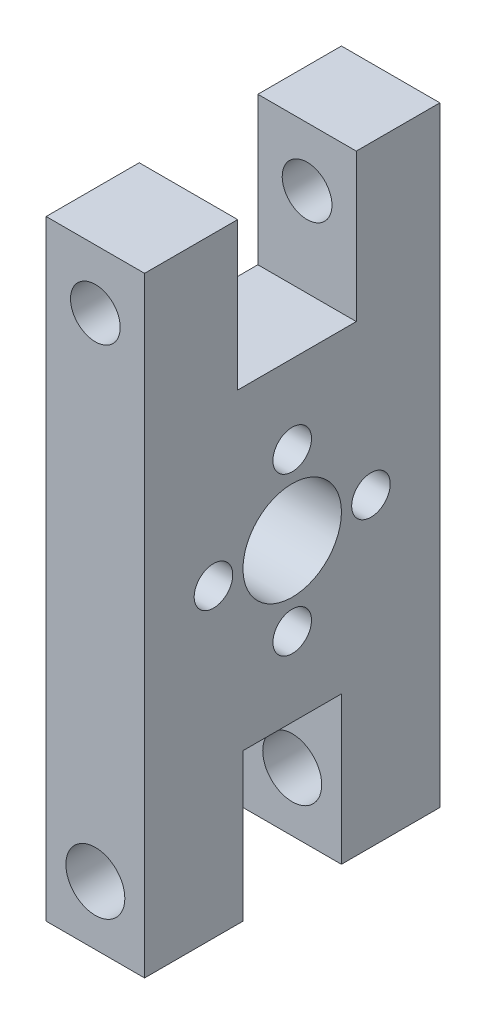
from build123d import *

# Parameters (mm, degrees)
CROQUIS1_R              = 5
CROQUIS1_R_2            = 1.95828143
SALIENTE_EXTRUIR1_DEPTH = 10
CROQUIS2_R              = 2.526447491
CROQUIS2_R_2            = 2.994638929
CORTAR_EXTRUIR1_DEPTH   = 45.283179651


with BuildPart() as part:
    # Croquis1 → Saliente-Extruir1 (new body)
    with BuildSketch(Plane(origin=(0, 0, 0), x_dir=(0, 0, -1), z_dir=(1, 0, 0))):
        Polygon((15, -31), (5, -31), (5, -16), (-5, -16), (-5, -31), (-15, -31), (-15, 31), (-5.542055275, 31), (-5.542055275, 16), (6.50834207, 16), (6.50834207, 31), (15, 31), align=None)
        Circle(CROQUIS1_R, mode=Mode.SUBTRACT)
        with Locations((-8, 0)):
            Circle(CROQUIS1_R_2, mode=Mode.SUBTRACT)
        with Locations((0, 8)):
            Circle(CROQUIS1_R_2, mode=Mode.SUBTRACT)
        with Locations((8, 0)):
            Circle(CROQUIS1_R_2, mode=Mode.SUBTRACT)
        with Locations((0, -8)):
            Circle(CROQUIS1_R_2, mode=Mode.SUBTRACT)
    extrude(amount=SALIENTE_EXTRUIR1_DEPTH)

    # Croquis2 → Cortar-Extruir1 (cut, through all)
    with BuildSketch(Plane.XY.offset(15)):
        with Locations((5, 25)):
            Circle(CROQUIS2_R)
        with Locations((5, -25)):
            Circle(CROQUIS2_R_2)
    extrude(amount=-CORTAR_EXTRUIR1_DEPTH, mode=Mode.SUBTRACT)


solid = part.part
